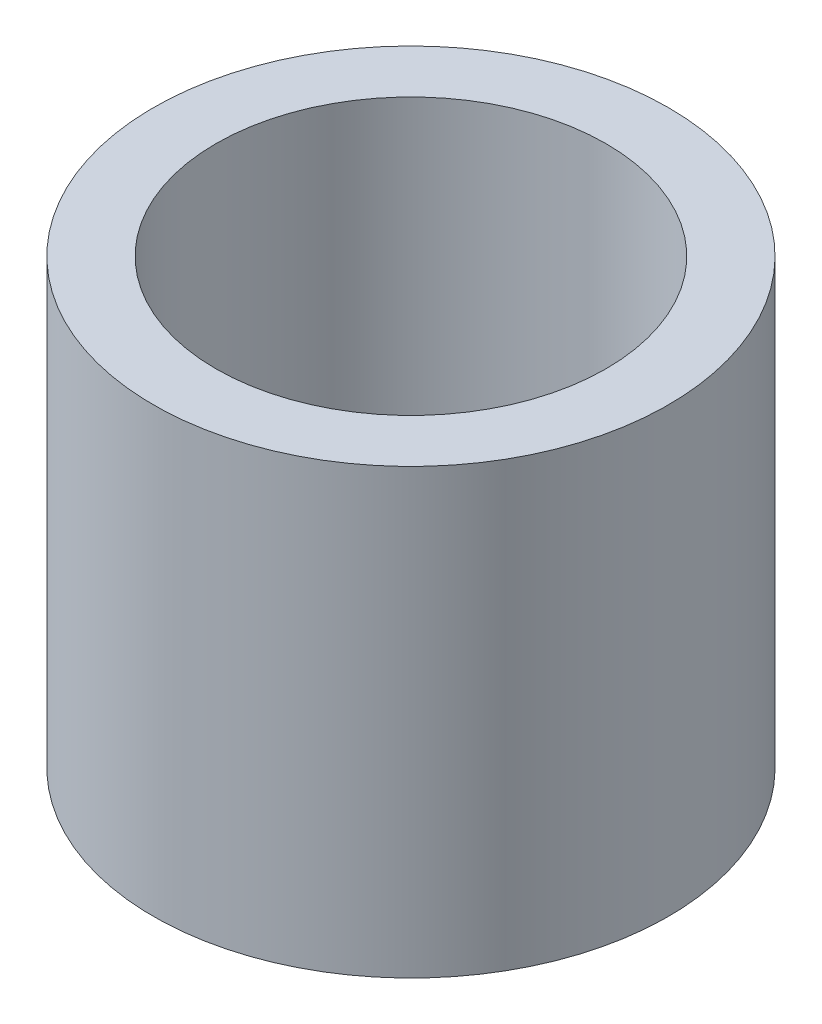
from build123d import *


with BuildPart() as part:
    # Эскиз1 → Повернуть1 (revolve)
    with BuildSketch(Plane.XY, mode=Mode.PRIVATE) as revolve_1_sk:
        Polygon((-2.5, 0), (-2.5, 2), (-6.25, 2), (-6.25, 14.197473599), (-8.25, 14.197473599), (-8.25, 0), align=None)
    revolve(revolve_1_sk.sketch.rotate(Axis((0, 0, 0), (0, 1, 0)), 270), axis=Axis((0, 0, 0), (0, 1, 0)))


solid = part.part
